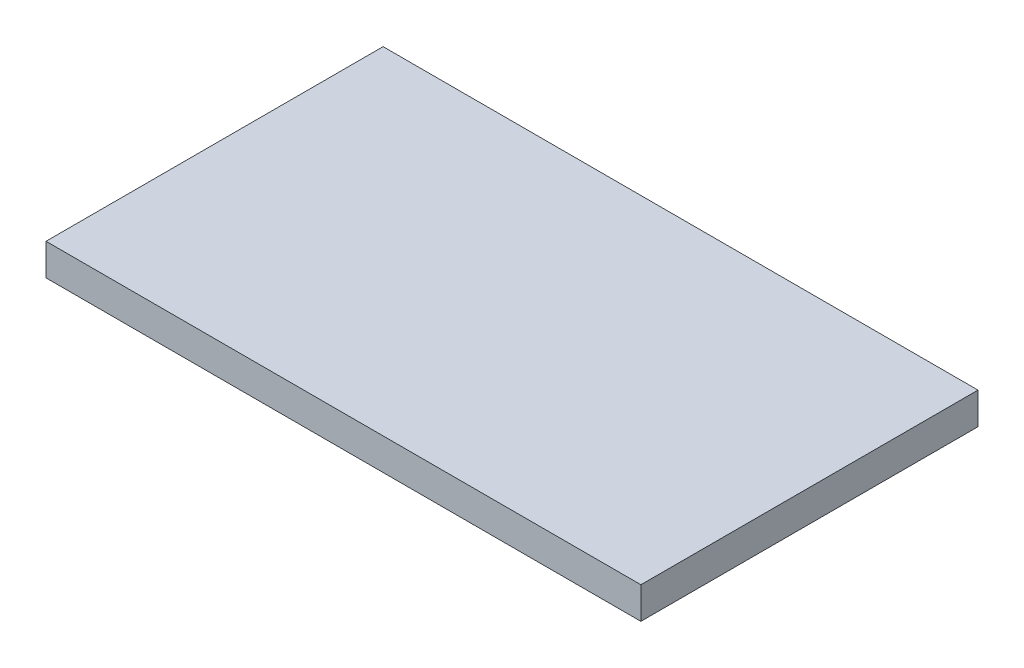
from build123d import *

# Parameters (mm, degrees)
SKETCH_1_W      = 150
SKETCH_1_H      = 85
EXTRUDE_1_DEPTH = 8


with BuildPart() as part:
    # Эскиз1 → Бобышка-Вытянуть1 (new body)
    with BuildSketch(Plane(origin=(0, 0, 0), x_dir=(1, 0, 0), z_dir=(0, 1, 0))):
        Rectangle(SKETCH_1_W, SKETCH_1_H)
    extrude(amount=EXTRUDE_1_DEPTH)


solid = part.part
